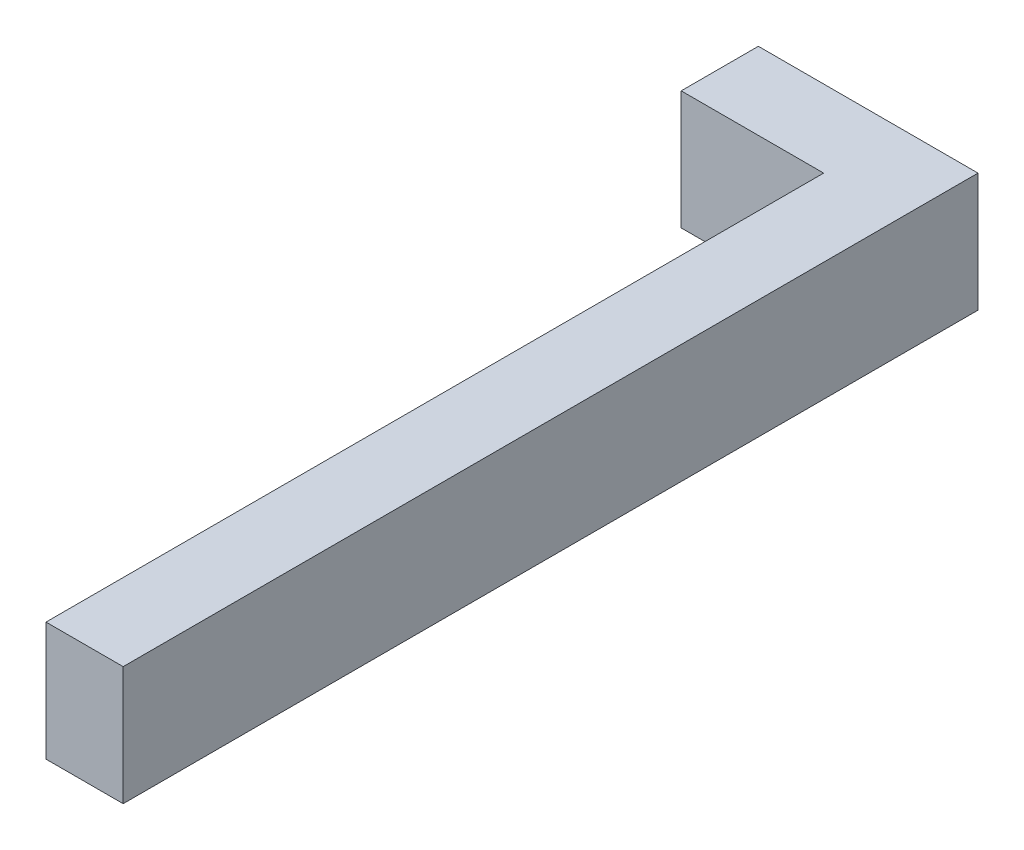
from build123d import *

# Parameters (mm, degrees)
BOSS_EXTRUDE1_DEPTH = 127


with BuildPart() as part:
    # Sketch1 → Boss-Extrude1 (new body)
    with BuildSketch(Plane(origin=(0, 0, 0), x_dir=(1, 0, 0), z_dir=(0, 1, 0))):
        Polygon((0, 0), (152.4, 0), (152.4, -831.85), (234.95, -831.85), (234.95, 0), (234.95, 82.55), (0, 82.55), align=None)
    extrude(amount=BOSS_EXTRUDE1_DEPTH)


solid = part.part
